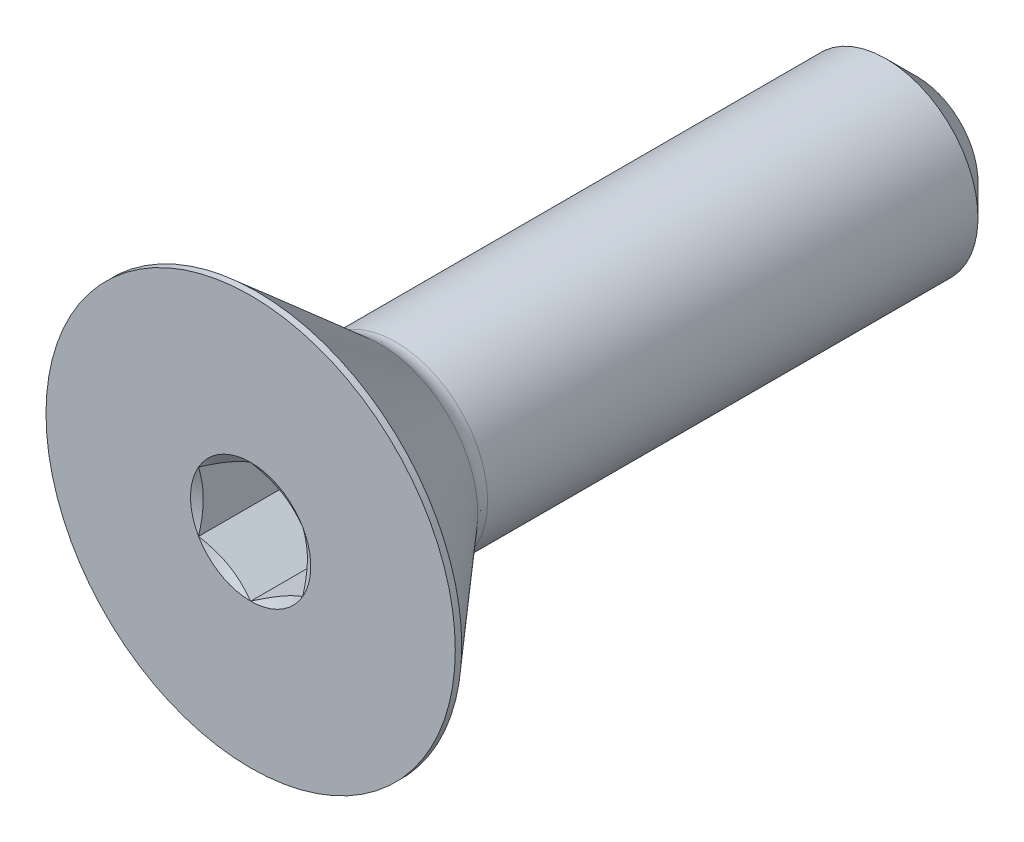
from build123d import *

# Parameters (mm, degrees)
SKETCH1_W          = 12.7
SKETCH1_H          = 1.7526
CHAMFER1_SIZE      = 0.5953125
CUT_EXTRUDE2_DEPTH = 1.72466


with BuildPart() as part:
    # Sketch1 → Revolve1 (revolve)
    with BuildSketch(Plane(origin=(0, 0, 0), x_dir=(0, 0, -1), z_dir=(1, 0, 0))):
        with Locations((6.35, 0.8763)):
            Rectangle(SKETCH1_W, SKETCH1_H)
    revolve(axis=Axis((0, 0, -12.7), (0, 0, 1)))

    # Chamfer1
    chamfer1_edges = [part.edges().sort_by_distance(p)[0] for p in [
        (0, -1.7526, -12.7),
    ]]
    chamfer(chamfer1_edges, length=CHAMFER1_SIZE)

    # Sketch7 → Revolve2 (revolve)
    with BuildSketch(Plane(origin=(0, 0, 0), x_dir=(0, 0, -1), z_dir=(1, 0, 0)), mode=Mode.PRIVATE) as revolve2_sk:
        with BuildLine():
            Line((0, 3.8989), (0.12319, 3.8989))
            Line((0.12319, 3.8989), (2.4638, 1.864238769))
            ThreePointArc((2.4638, 1.864238769), (2.603001936, 1.781422319), (2.76239145, 1.7526))
            Line((2.76239145, 1.7526), (2.76239145, 0))
            Line((2.76239145, 0), (0, 0))
            Line((0, 0), (0, 3.8989))
        make_face()
    revolve(revolve2_sk.sketch.rotate(Axis((0, 0, 0), (0, 0, -1)), 180), axis=Axis((0, 0, 0), (0, 0, -1)))

    # Boss-Extrude1 cone 1 section (through the dimple's axis) → Boss-Extrude1 (revolve)
    with BuildSketch(Plane(origin=(0, 0, -2.76239145), x_dir=(0, -1, 0), z_dir=(1, 0, 0))):
        Polygon((0, 0), (1.7526, 0), (0, 1.692466147), align=None)
    revolve(axis=Axis((0, 0, -2.76239145), (0, 0, -1)))

    # Sketch5 → Cut-Extrude2 (cut)
    with BuildSketch(Plane.XY):
        Polygon((0, 1.14567944), (-0.9921875, 0.57283972), (-0.9921875, -0.57283972), (0, -1.14567944), (0.9921875, -0.57283972), (0.9921875, 0.57283972), align=None)
    extrude(amount=-CUT_EXTRUDE2_DEPTH, mode=Mode.SUBTRACT)

    # Cut-Extrude3 cone 1 section (through the dimple's axis) → Cut-Extrude3 (revolve, cut)
    with BuildSketch(Plane(origin=(0, 0, 0), x_dir=(0, -1, 0), z_dir=(1, 0, 0))):
        Polygon((0, 0), (1.14567944, 0), (0, 0.661458333), align=None)
    revolve(axis=Axis((0, 0, 0), (0, 0, -1)), mode=Mode.SUBTRACT)


solid = part.part
